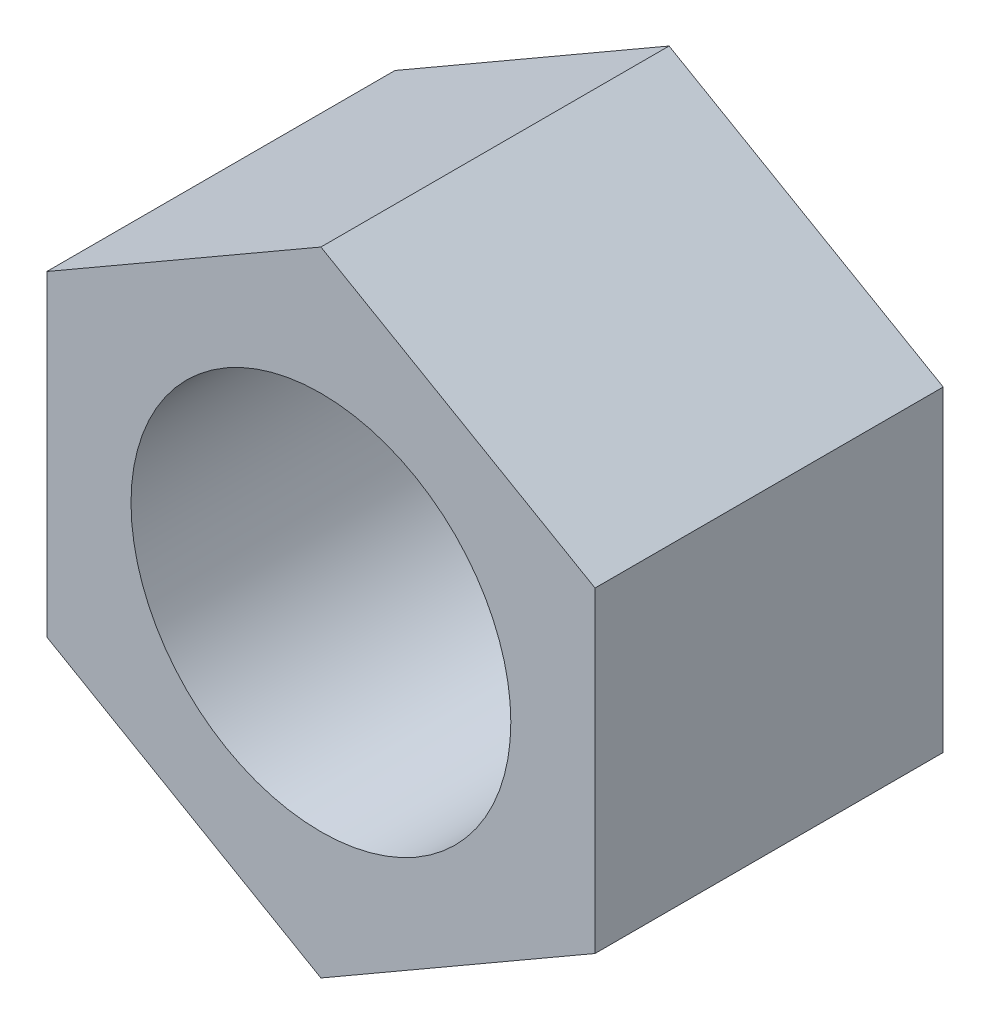
from build123d import *

# Parameters (mm, degrees)
BOSS_EXTRUDE1_DEPTH = 5.5
CUT_EXTRUDE1_REACH  = 10.602
SKETCH2_R           = 3


with BuildPart() as part:
    # Sketch1 → Boss-Extrude1 (new body)
    with BuildSketch(Plane(origin=(0, 0, 0), x_dir=(0, 1, 0), z_dir=(0, 0, 1))):
        Polygon((5, 0), (2.5, 4.330127019), (-2.5, 4.330127019), (-5, 0), (-2.5, -4.330127019), (2.5, -4.330127019), align=None)
    extrude(amount=BOSS_EXTRUDE1_DEPTH)

    # Sketch2 → Cut-Extrude1 (cut, up to next)
    with BuildSketch(Plane.XY.offset(5.5), mode=Mode.PRIVATE) as cut_extrude1_sk1:
        Circle(SKETCH2_R)
    cut_extrude1_tool1 = extrude(cut_extrude1_sk1.sketch, amount=-CUT_EXTRUDE1_REACH, mode=Mode.PRIVATE) & part.part
    add(cut_extrude1_tool1.solids().sort_by_distance((0, 0, 5.5))[0], mode=Mode.SUBTRACT)


solid = part.part
